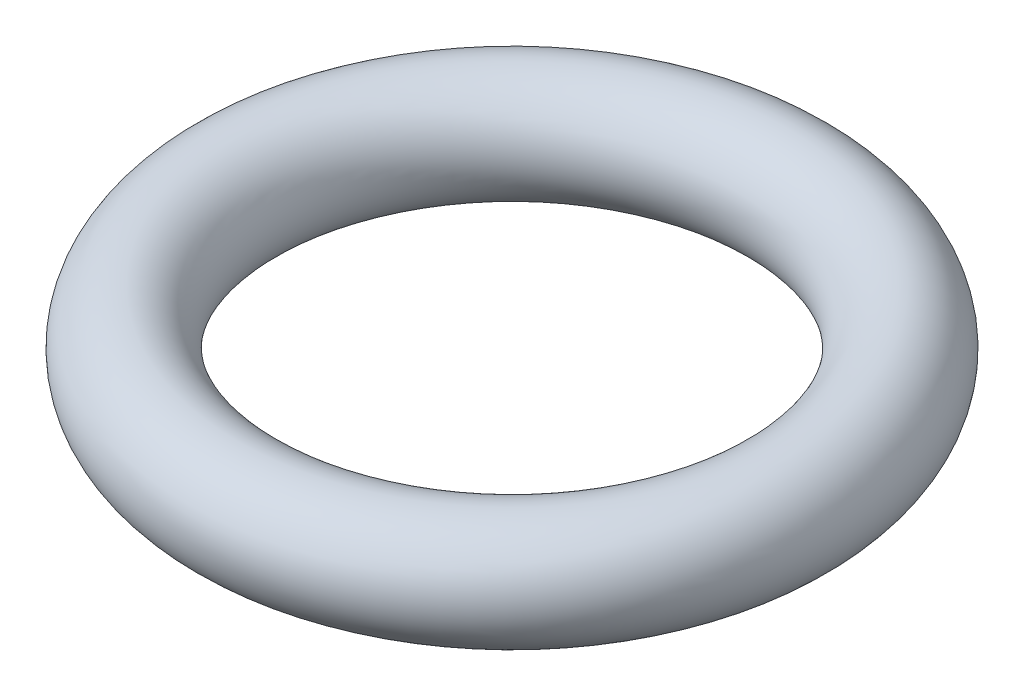
from build123d import *

# Parameters (mm, degrees)
SKETCH1_R = 1


with BuildPart() as part:
    # Sketch1 → Revolve1 (revolve)
    with BuildSketch(Plane.XY, mode=Mode.PRIVATE) as revolve1_sk:
        with Locations((5, 0)):
            Circle(SKETCH1_R)
    revolve(revolve1_sk.sketch.rotate(Axis((0, 0, 0), (0, 1, 0)), 90), axis=Axis((0, 0, 0), (0, 1, 0)))


solid = part.part
